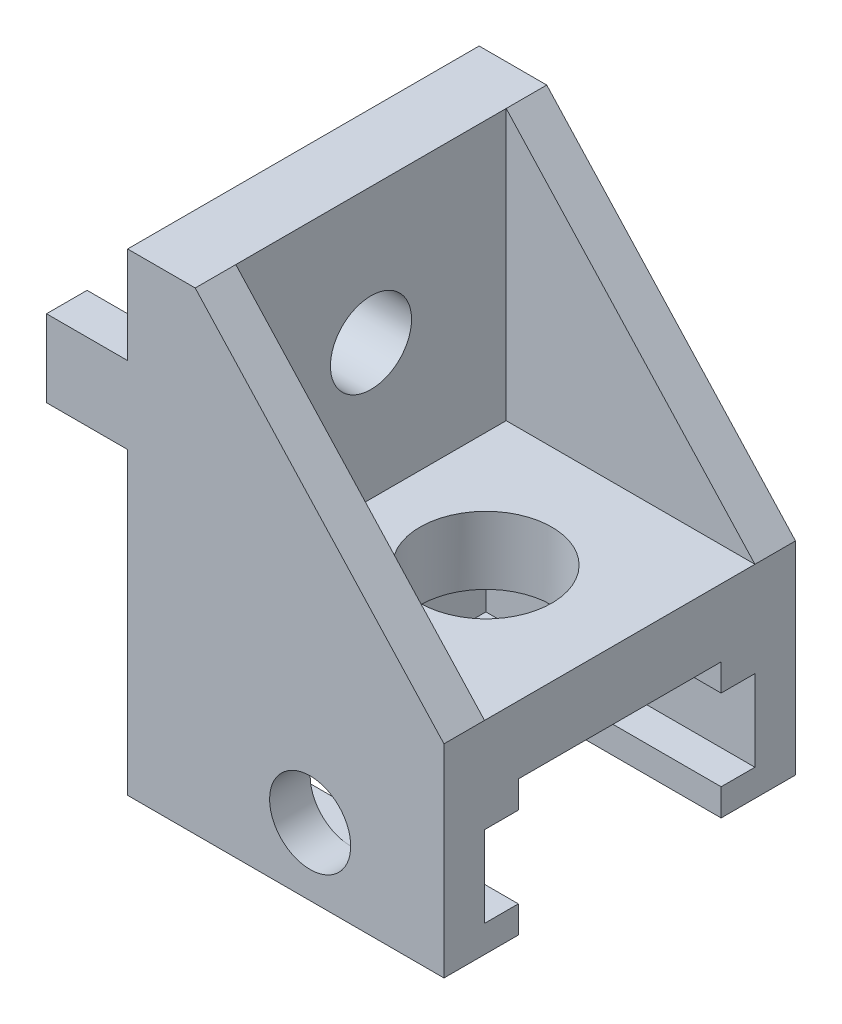
from build123d import *

# Parameters (mm, degrees)
SKETCH1_W           = 27
SKETCH1_H           = 26
BOSS_EXTRUDE1_DEPTH = 15
CUT_EXTRUDE2_DEPTH  = 23.5
SKETCH5_W           = 3.601284645
SKETCH5_H           = 15
CUT_EXTRUDE3_DEPTH  = 33.912763482
SKETCH6_R           = 3
CUT_EXTRUDE4_DEPTH  = 33.912763482
SKETCH7_W           = 5
SKETCH7_H           = 26
BOSS_EXTRUDE2_DEPTH = 20
SKETCH8_W           = 6
SKETCH8_H           = 5.7
BOSS_EXTRUDE3_DEPTH = 3
SKETCH9_W           = 6
SKETCH9_H           = 5.7
BOSS_EXTRUDE4_DEPTH = 3
SKETCH10_R          = 3
CUT_EXTRUDE5_DEPTH  = 42.623463656
SKETCH11_R          = 4.875
CUT_EXTRUDE6_DEPTH  = 31.809901006


with BuildPart() as part:
    # Sketch1 → Boss-Extrude1 (new body)
    with BuildSketch(Plane(origin=(0, 0, 0), x_dir=(1, 0, 0), z_dir=(0, 1, 0))):
        Rectangle(SKETCH1_W, SKETCH1_H)
    extrude(amount=BOSS_EXTRUDE1_DEPTH)

    # Sketch4 → Cut-Extrude2 (cut)
    with BuildSketch(Plane(origin=(13.5, 0, 0), x_dir=(0, 0, -1), z_dir=(1, 0, 0))):
        Polygon((-10, 2), (-7.5, 2), (-7.5, 0), (7.5, 0), (7.5, 2), (10, 2), (10, 8), (7.5, 8), (7.5, 10), (-7.5, 10), (-7.5, 8), (-10, 8), align=None)
    extrude(amount=-CUT_EXTRUDE2_DEPTH, mode=Mode.SUBTRACT)

    # Sketch5 → Cut-Extrude3 (cut, through all)
    with BuildSketch(Plane(origin=(0, 0, -13), x_dir=(-1, 0, 0), z_dir=(0, 0, -1))):
        with Locations((-11.699357678, 7.5)):
            Rectangle(SKETCH5_W, SKETCH5_H)
    extrude(amount=-CUT_EXTRUDE3_DEPTH, mode=Mode.SUBTRACT)

    # Sketch6 → Cut-Extrude4 (cut, through all)
    with BuildSketch(Plane(origin=(0, 0, -13), x_dir=(-1, 0, 0), z_dir=(0, 0, -1))):
        with Locations((0, 5)):
            Circle(SKETCH6_R)
    extrude(amount=-CUT_EXTRUDE4_DEPTH, mode=Mode.SUBTRACT)

    # Sketch7 → Boss-Extrude2 (add)
    with BuildSketch(Plane(origin=(0, 15, 0), x_dir=(1, 0, 0), z_dir=(0, 1, 0))):
        with Locations((-11, 0)):
            Rectangle(SKETCH7_W, SKETCH7_H)
    extrude(amount=BOSS_EXTRUDE2_DEPTH)

    # Sketch8 → Boss-Extrude3 (add)
    with BuildSketch(Plane(origin=(0, 0, -13), x_dir=(-1, 0, 0), z_dir=(0, 0, -1))):
        Polygon((8.5, 35), (-9.898715355, 15), (8.5, 15), align=None)
        with Locations((16.5, 25)):
            Rectangle(SKETCH8_W, SKETCH8_H)
    extrude(amount=-BOSS_EXTRUDE3_DEPTH)

    # Sketch9 → Boss-Extrude4 (add)
    with BuildSketch(Plane.XY.offset(13)):
        Polygon((-8.5, 35), (9.898715355, 15), (-8.5, 15), align=None)
        with Locations((-16.5, 25)):
            Rectangle(SKETCH9_W, SKETCH9_H)
    extrude(amount=-BOSS_EXTRUDE4_DEPTH)

    # Sketch10 → Cut-Extrude5 (cut, through all)
    with BuildSketch(Plane(origin=(-8.5, 0, 0), x_dir=(0, 0, -1), z_dir=(1, 0, 0))):
        with Locations((0, 25)):
            Circle(SKETCH10_R)
    extrude(amount=-CUT_EXTRUDE5_DEPTH, mode=Mode.SUBTRACT)

    # Sketch11 → Cut-Extrude6 (cut, through all)
    with BuildSketch(Plane(origin=(0, 15, 0), x_dir=(1, 0, 0), z_dir=(0, 1, 0))):
        with Locations(Location((0, 0, 0), (0, 0, 270))):
            Circle(SKETCH11_R)
    extrude(amount=-CUT_EXTRUDE6_DEPTH, mode=Mode.SUBTRACT)


solid = part.part
